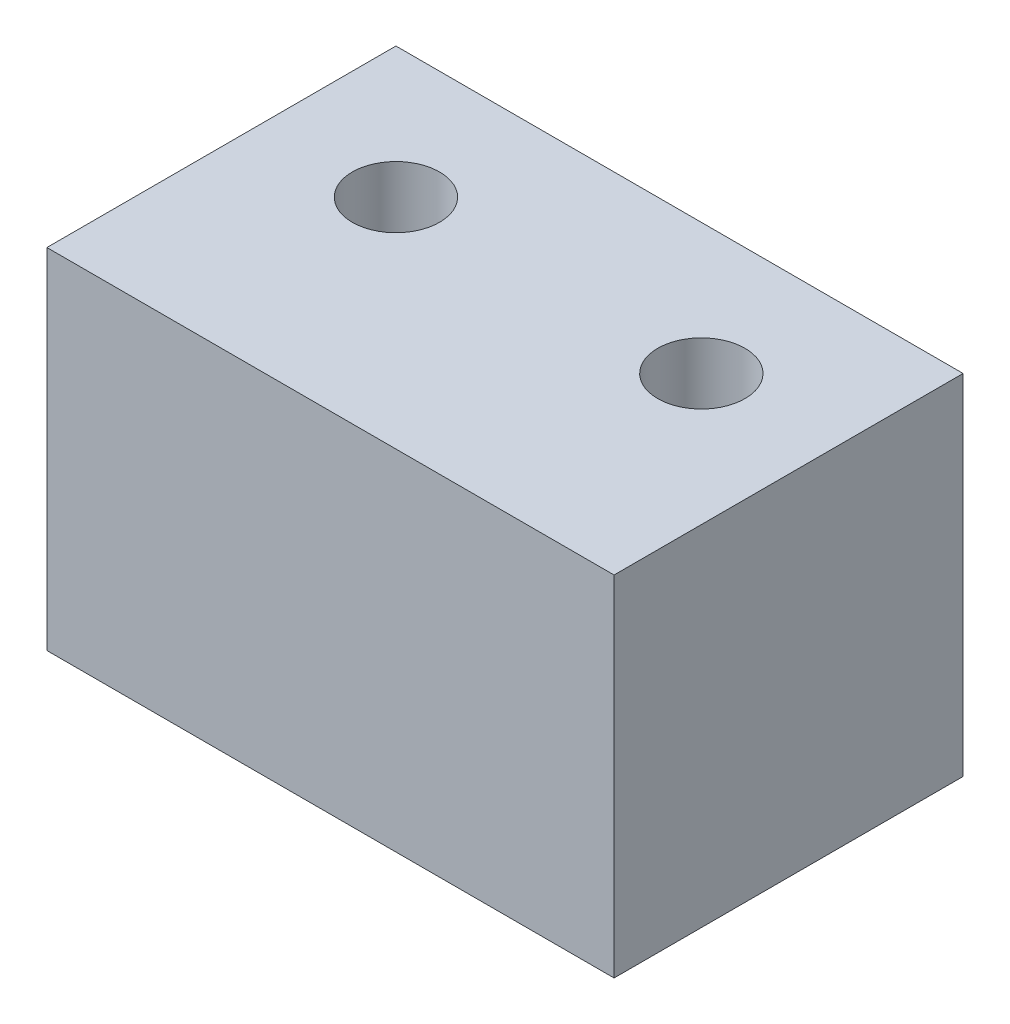
from build123d import *

# Parameters (mm, degrees)
SKETCH1_W                   = 82.55
SKETCH1_H                   = 50.8
BOSS_EXTRUDE1_DEPTH         = 25.4
F_1_2_0_5000_DOWEL_HOLE1_D  = 12.7
F_1_4_20_TAPPED_HOLE1_D     = 5.1054
F_1_4_20_TAPPED_HOLE1_DEPTH = 12.7
F_1_4_20_TAPPED_HOLE1_TIP   = 1.533816902


with BuildPart() as part:
    # Sketch1 → Boss-Extrude1 (new, symmetric)
    with BuildSketch(Plane(origin=(0, 0, 0), x_dir=(1, 0, 0), z_dir=(0, 1, 0))):
        Rectangle(SKETCH1_W, SKETCH1_H)
    extrude(amount=BOSS_EXTRUDE1_DEPTH, both=True)

    # 1/2 (0.5000) Dowel Hole1 (through all)
    with Locations(Plane(origin=(0, 25.4, 0), x_dir=(1, 0, 0), z_dir=(0, 1, 0))):
        with Locations((22.225, 6.35), (-22.225, 6.35)):
            Hole(F_1_2_0_5000_DOWEL_HOLE1_D / 2)

    # 1/4-20 Tapped Hole1
    with Locations(Plane.ZY.offset(41.275)):
        with Locations((0, 12.7), (0, -12.7)):
            Hole(F_1_4_20_TAPPED_HOLE1_D / 2, depth=F_1_4_20_TAPPED_HOLE1_DEPTH)
            with Locations((0, 0, -(F_1_4_20_TAPPED_HOLE1_DEPTH + F_1_4_20_TAPPED_HOLE1_TIP / 2))):  # 118° drill point
                Cone(0, F_1_4_20_TAPPED_HOLE1_D / 2, F_1_4_20_TAPPED_HOLE1_TIP, mode=Mode.SUBTRACT)


solid = part.part
